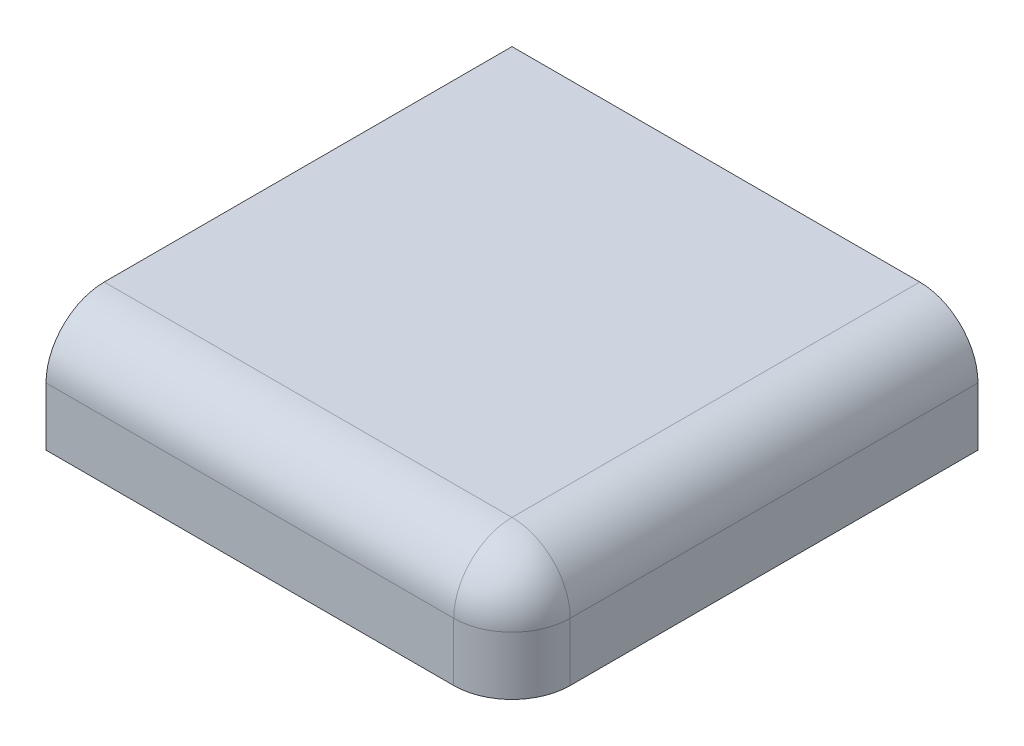
from build123d import *

# Parameters (mm, degrees)
SKETCH_1_W               = 40
SKETCH_1_H               = 40
EXTRUDE_1_DEPTH          = 10
SKETCH_7_R               = 2.575
CUT_EXTRUDE_2_DEPTH      = 3.15
PATTERN_CIRCULAR_1_COUNT = 2
PATTERN_CIRCULAR_1_ANGLE = 90
FILLET_2_R               = 5


with BuildPart() as part:
    # Эскиз1 → Бобышка-Вытянуть1 (new body)
    with BuildSketch(Plane(origin=(0, 0, 0), x_dir=(1, 0, 0), z_dir=(0, 1, 0))):
        Rectangle(SKETCH_1_W, SKETCH_1_H)
    extrude(amount=-EXTRUDE_1_DEPTH)

    # Эскиз7 → Вырез-Вытянуть2 (cut)
    with BuildSketch(Plane.ZY.offset(20)):
        with Locations((0, -5.199176943)):
            Circle(SKETCH_7_R)
        with BuildLine():
            Line((1.2875, -2.969161528), (0, -2.225823057))
            Line((0, -2.225823057), (-1.2875, -2.969161528))
            ThreePointArc((-1.2875, -2.969161528), (0, -2.624176943), (1.2875, -2.969161528))
        make_face()
    cut_extrude_2 = extrude(amount=-CUT_EXTRUDE_2_DEPTH, mode=Mode.SUBTRACT)

    # Круговой массив1: Вырез-Вытянуть2 ×2 about axis
    pattern_circular_1_axis = Axis((0, -10, 0), (0, -1, 0))
    for i in range(1, PATTERN_CIRCULAR_1_COUNT):
        add(cut_extrude_2.rotate(pattern_circular_1_axis, i * PATTERN_CIRCULAR_1_ANGLE / (PATTERN_CIRCULAR_1_COUNT - 1)), mode=Mode.SUBTRACT)

    # Скругление2
    fillet_2_edges = [part.edges().sort_by_distance(p)[0] for p in [
        (20, 0, 0),
        (0, 0, 20),
        (20, -5, 20),
    ]]
    fillet(fillet_2_edges, radius=FILLET_2_R)


solid = part.part
